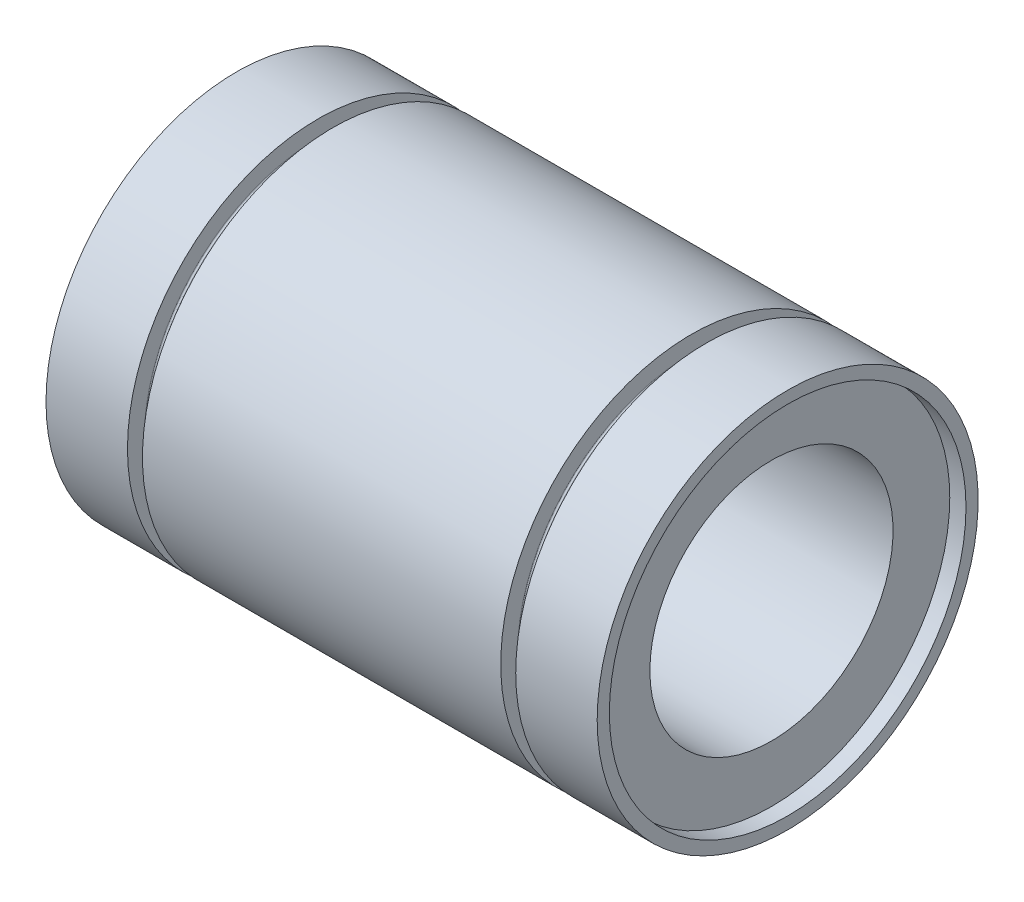
from build123d import *


with BuildPart() as part:
    # Sketch1 → Revolve1 (revolve)
    with BuildSketch(Plane(origin=(0, 0, 0), x_dir=(1, 0, 0), z_dir=(0, 1, 0)), mode=Mode.PRIVATE) as revolve1_sk:
        Polygon((0, 23.5), (0, 15), (32, 15), (32, 22), (34, 22), (34, 23.5), align=None)
    revolve(revolve1_sk.sketch.rotate(Axis((0, 0, 0), (1, 0, 0)), 180), axis=Axis((0, 0, 0), (1, 0, 0)))

    # Sketch7 → Groove for DIN 471 - 45 x 1.75, Circlip for shafts - normal1 (revolve, cut)
    with BuildSketch(Plane(origin=(0, 0, 0), x_dir=(0, 0, 1), z_dir=(0, -1, 0))):
        with BuildLine():
            Line((21.435, -23.95), (28.2, -23.95))
            Line((28.2, -23.95), (28.2, -22.1))
            Line((28.2, -22.1), (21.435, -22.1))
            ThreePointArc((21.435, -22.1), (21.304185245, -22.154185245), (21.25, -22.285))
            Line((21.25, -22.285), (21.25, -23.765))
            ThreePointArc((21.25, -23.765), (21.304185245, -23.895814755), (21.435, -23.95))
        make_face()
    revolve(axis=Axis((50, 0, 0), (-1, 0, 0)), mode=Mode.SUBTRACT)

    # Mirror2: part across plane


with BuildPart() as part_1:
    add(part.part)
    add(part.part.mirror(Plane.ZY))


solid = part_1.part
